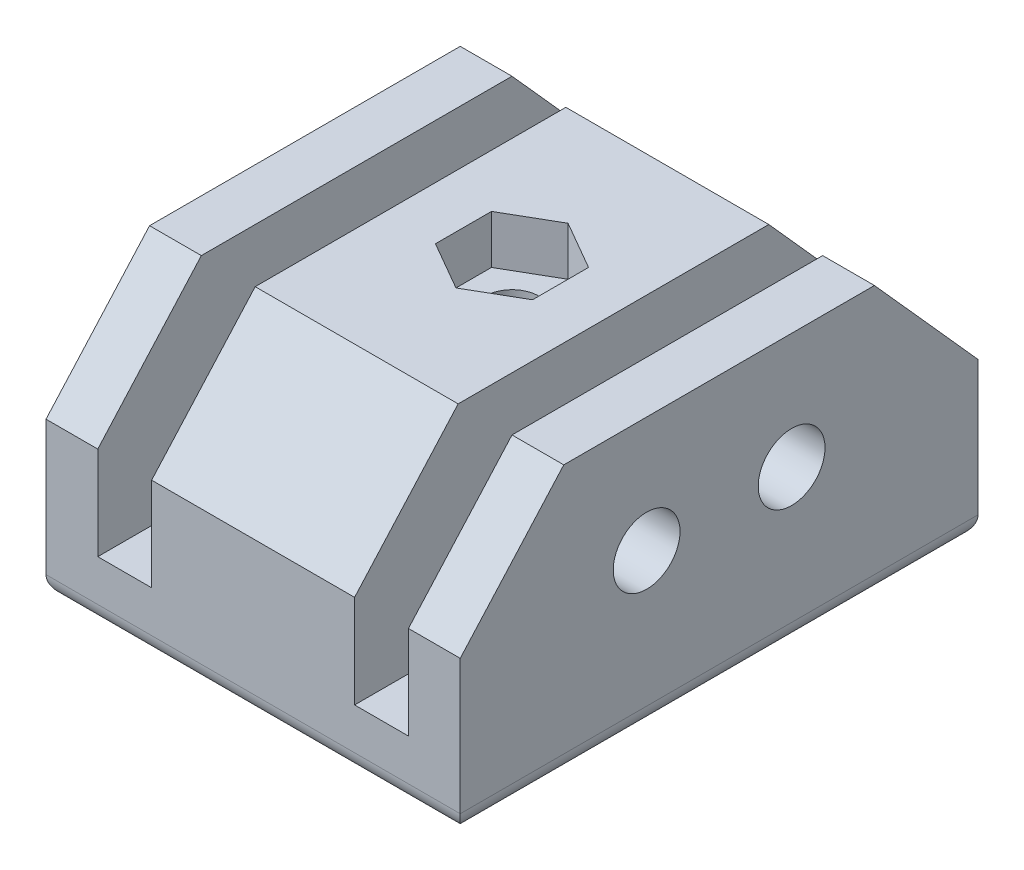
from build123d import *

# Parameters (mm, degrees)
SKETCH1_W           = 63.5
SKETCH1_H           = 6.35
BOSS_EXTRUDE1_DEPTH = 50.8
BOSS_EXTRUDE2_DEPTH = 50.8
SKETCH10_W          = 6.604
SKETCH10_H          = 25.629031657
CUT_EXTRUDE1_DEPTH  = 88.854357354
LPATTERN3_COUNT     = 2
LPATTERN3_PITCH     = 31.496
SKETCH11_R          = 4.09575
CUT_EXTRUDE2_DEPTH  = 88.854357354
CUT_EXTRUDE3_DEPTH  = 5.953125
LPATTERN4_COUNT     = 2
LPATTERN4_PITCH     = 27.94
SKETCH20_R          = 3.302
CUT_EXTRUDE4_DEPTH  = 21.986875
FILLET1_R           = 2.54


with BuildPart() as part:
    # Sketch1 → Boss-Extrude1 (new body)
    with BuildSketch(Plane(origin=(0, 0, 0), x_dir=(0, 0, -1), z_dir=(1, 0, 0))):
        with Locations((31.75, 3.175)):
            Rectangle(SKETCH1_W, SKETCH1_H)
    extrude(amount=-BOSS_EXTRUDE1_DEPTH)

    # Sketch2 → Boss-Extrude2 (add)
    with BuildSketch(Plane(origin=(0, 0, 0), x_dir=(0, 0, -1), z_dir=(1, 0, 0))):
        Polygon((0, 6.35), (0, 19.05), (12.7, 33.249031657), (50.8, 33.249031657), (63.5, 19.05), (63.5, 6.35), align=None)
    extrude(amount=-BOSS_EXTRUDE2_DEPTH)

    # Sketch10 → Cut-Extrude1 (cut, through all)
    with BuildSketch(Plane(origin=(0, 0, -63.5), x_dir=(-1, 0, 0), z_dir=(0, 0, -1))):
        with Locations((9.652, 20.434515829)):
            Rectangle(SKETCH10_W, SKETCH10_H)
    cut_extrude1 = extrude(amount=-CUT_EXTRUDE1_DEPTH, mode=Mode.SUBTRACT)

    # LPattern3: Cut-Extrude1 ×2
    with Locations(*[(-i * LPATTERN3_PITCH, 0, 0) for i in range(1, LPATTERN3_COUNT)]):
        add(cut_extrude1, mode=Mode.SUBTRACT)

    # Sketch11 → Cut-Extrude2 (cut, through all)
    with BuildSketch(Plane(origin=(0, 0, 0), x_dir=(0, 0, -1), z_dir=(1, 0, 0))):
        with Locations((22.86, 19.05)):
            Circle(SKETCH11_R)
        with Locations((40.64, 19.05)):
            Circle(SKETCH11_R)
    extrude(amount=-CUT_EXTRUDE2_DEPTH, mode=Mode.SUBTRACT)

    # Sketch19 → Cut-Extrude3 (cut)
    with BuildSketch(Plane(origin=(0, 33.249031657, 0), x_dir=(1, 0, 0), z_dir=(0, 1, 0))):
        Polygon((-19.448913651, 35.185861306), (-25.4, 38.621722611), (-31.351086349, 35.185861306), (-31.351086349, 28.314138694), (-25.4, 24.878277389), (-19.448913651, 28.314138694), align=None)
    cut_extrude3 = extrude(amount=-CUT_EXTRUDE3_DEPTH, mode=Mode.SUBTRACT)

    # LPattern4: Cut-Extrude3 ×2
    with Locations(*[(0, -i * LPATTERN4_PITCH, 0) for i in range(1, LPATTERN4_COUNT)]):
        add(cut_extrude3, mode=Mode.SUBTRACT)

    # Sketch20 → Cut-Extrude4 (cut)
    with BuildSketch(Plane(origin=(0, 27.295906657, 0), x_dir=(1, 0, 0), z_dir=(0, 1, 0))):
        with Locations(Location((-25.4, 31.75, 0), (0, 0, 270))):
            Circle(SKETCH20_R)
    extrude(amount=-CUT_EXTRUDE4_DEPTH, mode=Mode.SUBTRACT)

    # Fillet1
    fillet1_edges = [part.edges().sort_by_distance(p)[0] for p in [
        (0, 0, -31.75),
        (-50.8, 0, -31.75),
        (-25.4, 0, -63.5),
        (-25.4, 0, 0),
    ]]
    fillet(fillet1_edges, radius=FILLET1_R)


solid = part.part
